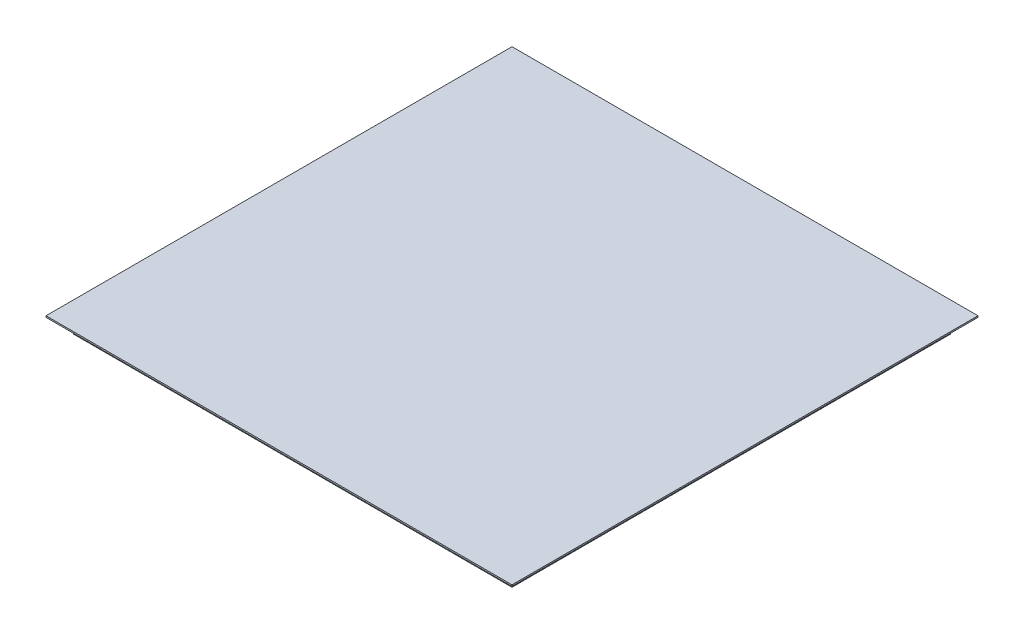
from build123d import *

# Parameters (mm, degrees)
SKETCH_1_W          = 640
SKETCH_1_H          = 640
EXTRUDE_1_DEPTH     = 2
SKETCH_2_W          = 602
SKETCH_2_H          = 602
SKETCH_2_W_2        = 598
SKETCH_2_H_2        = 598
EXTRUDE_2_DEPTH     = 20
SKETCH_4_R          = 12.5
CUT_EXTRUDE_1_DEPTH = 453.990066116
CUT_EXTRUDE_START   = 5
SKETCH_3_W          = 60
SKETCH_3_H          = 60
CUT_EXTRUDE_2_DEPTH = 2
EXTRUDE_START       = 5
SKETCH_3_2_W        = 60
SKETCH_3_2_H        = 60
EXTRUDE_3_DEPTH     = 2
SKETCH_5_R          = 1.6
CUT_EXTRUDE_3_DEPTH = 2
CUT_EXTRUDE_START_2 = 20
SKETCH_3_3_W        = 60
SKETCH_3_3_H        = 60
CUT_EXTRUDE_4_DEPTH = 8
CUT_EXTRUDE_5_DEPTH = 2
CUT_EXTRUDE_6_REACH = 455.989


with BuildPart() as part:
    # 草图1 → 凸台-拉伸1 (new body)
    with BuildSketch(Plane(origin=(0, 0, 0), x_dir=(1, 0, 0), z_dir=(0, 1, 0))):
        Rectangle(SKETCH_1_W, SKETCH_1_H)
    extrude(amount=EXTRUDE_1_DEPTH)

    # 草图2 → 凸台-拉伸2 (add)
    # profile 1 of 6: a face of its own
    with BuildSketch(Plane.XZ):
        Rectangle(SKETCH_2_W, SKETCH_2_H)
        Rectangle(SKETCH_2_W_2, SKETCH_2_H_2, mode=Mode.SUBTRACT)
    # profile 2 of 6: a face of its own
    with BuildSketch(Plane.XZ):
        Polygon((299, -297.585786438), (2.414213562, -1), (1, -1), (1, -2.414213562), (297.585786438, -299), (299, -299), align=None)
    # profile 3 of 6: a face of its own
    with BuildSketch(Plane.XZ):
        Polygon((-1, 2.414213562), (-297.585786438, 299), (-299, 299), (-299, 297.585786438), (-2.414213562, 1), (-1, 1), align=None)
    # profile 4 of 6: a face of its own
    with BuildSketch(Plane.XZ):
        Polygon((299, 1), (2.414213562, 1), (1, 1), (1, 2.414213562), (1, 299), (-1, 299), (-1, 2.414213562), (-1, 1), (-2.414213562, 1), (-299, 1), (-299, -1), (-2.414213562, -1), (-1, -1), (-1, -2.414213562), (-1, -299), (1, -299), (1, -2.414213562), (1, -1), (2.414213562, -1), (299, -1), align=None)
    # profile 5 of 6: a face of its own
    with BuildSketch(Plane.XZ):
        Polygon((2.414213562, 1), (299, 297.585786438), (299, 299), (297.585786438, 299), (1, 2.414213562), (1, 1), align=None)
    # profile 6 of 6: a face of its own
    with BuildSketch(Plane.XZ):
        Polygon((-297.585786438, -299), (-1, -2.414213562), (-1, -1), (-2.414213562, -1), (-299, -297.585786438), (-299, -299), align=None)
    extrude(amount=EXTRUDE_2_DEPTH)

    # 草图4 → 切除-拉伸1 (cut, through all)
    with BuildSketch(Plane.XZ):
        Circle(SKETCH_4_R)
    extrude(amount=CUT_EXTRUDE_1_DEPTH, mode=Mode.SUBTRACT)

    # 草图3 → 切除-拉伸2 (cut)
    with BuildSketch(Plane.XZ.offset(CUT_EXTRUDE_START)):
        Rectangle(SKETCH_3_W, SKETCH_3_H)
    extrude(amount=CUT_EXTRUDE_2_DEPTH, mode=Mode.SUBTRACT)

    # 草图3<3> → 切除-拉伸4 (cut)
    with BuildSketch(Plane.XZ.offset(CUT_EXTRUDE_START_2)):
        Rectangle(SKETCH_3_3_W, SKETCH_3_3_H)
    extrude(amount=-CUT_EXTRUDE_4_DEPTH, mode=Mode.SUBTRACT)

    # 草图7 → 切除-拉伸5 (cut)
    with BuildSketch(Plane(origin=(0, 0, -1), x_dir=(-1, 0, 0), z_dir=(0, 0, -1))):
        Polygon((-30, -12), (-30, -20), (-50, -20), align=None)
        Polygon((50, -20), (30, -12), (30, -20), align=None)
    extrude(amount=-CUT_EXTRUDE_5_DEPTH, mode=Mode.SUBTRACT)

    # 切除-拉伸6: up to this face of the body (flat: up to its plane)
    cut_extrude_6_end = Plane(part.part.faces().sort_by_distance((-159.191604646, -9.853299667, 157.777391083))[0])
    # 草图8 → 切除-拉伸6 (cut, up to the picked face)
    with BuildSketch(Plane(origin=(0.7071067811864107, 0, 0.7071067811864109), x_dir=(0.7071067811865476, 0, -0.7071067811865476), z_dir=(0.7071067811865476, 0, 0.7071067811865476)), mode=Mode.PRIVATE) as cut_extrude_6_sk1:
        Polygon((-41.426406871, -12), (-41.426406871, -20), (-61.426406871, -20), align=None)
    cut_extrude_6_tool1 = split(extrude(cut_extrude_6_sk1.sketch, amount=-CUT_EXTRUDE_6_REACH, mode=Mode.PRIVATE), bisect_by=cut_extrude_6_end, keep=Keep.BOTH, mode=Mode.PRIVATE)
    # 草图8 → 切除-拉伸6 (cut, up to the picked face)
    with BuildSketch(Plane(origin=(0.7071067811864107, 0, 0.7071067811864109), x_dir=(0.7071067811865476, 0, -0.7071067811865476), z_dir=(0.7071067811865476, 0, 0.7071067811865476)), mode=Mode.PRIVATE) as cut_extrude_6_sk2:
        Polygon((61.426406871, -20), (41.426406871, -12), (41.426406871, -20), align=None)
    cut_extrude_6_tool2 = split(extrude(cut_extrude_6_sk2.sketch, amount=-CUT_EXTRUDE_6_REACH, mode=Mode.PRIVATE), bisect_by=cut_extrude_6_end, keep=Keep.BOTH, mode=Mode.PRIVATE)
    add(cut_extrude_6_tool1.solids().sort_by(Axis((-33.299832, -17.333333, 34.714045), (-0.7071067811865476, 0, -0.7071067811865476)))[0], mode=Mode.SUBTRACT)
    add(cut_extrude_6_tool2.solids().sort_by(Axis((34.714045, -17.333333, -33.299832), (-0.7071067811865476, 0, -0.7071067811865476)))[0], mode=Mode.SUBTRACT)


with BuildPart() as body_2:
    # 草图3<2> → 凸台-拉伸3 (new body)
    with BuildSketch(Plane.XZ.offset(EXTRUDE_START)):
        Rectangle(SKETCH_3_2_W, SKETCH_3_2_H)
    extrude(amount=EXTRUDE_3_DEPTH)

    # 草图5 → 切除-拉伸3 (cut)
    with BuildSketch(Plane.XZ.offset(7)):
        with Locations(Location((8.08, 0, 0), (0, 0, 270))):
            Circle(SKETCH_5_R)
        with Locations(Location((0, -8.08, 0), (0, 0, 270))):
            Circle(SKETCH_5_R)
        with Locations(Location((-8.08, 0, 0), (0, 0, 270))):
            Circle(SKETCH_5_R)
        with Locations(Location((0, 8.08, 0), (0, 0, 270))):
            Circle(SKETCH_5_R)
    extrude(amount=-CUT_EXTRUDE_3_DEPTH, mode=Mode.SUBTRACT)


solid = Compound([part.part, body_2.part])
